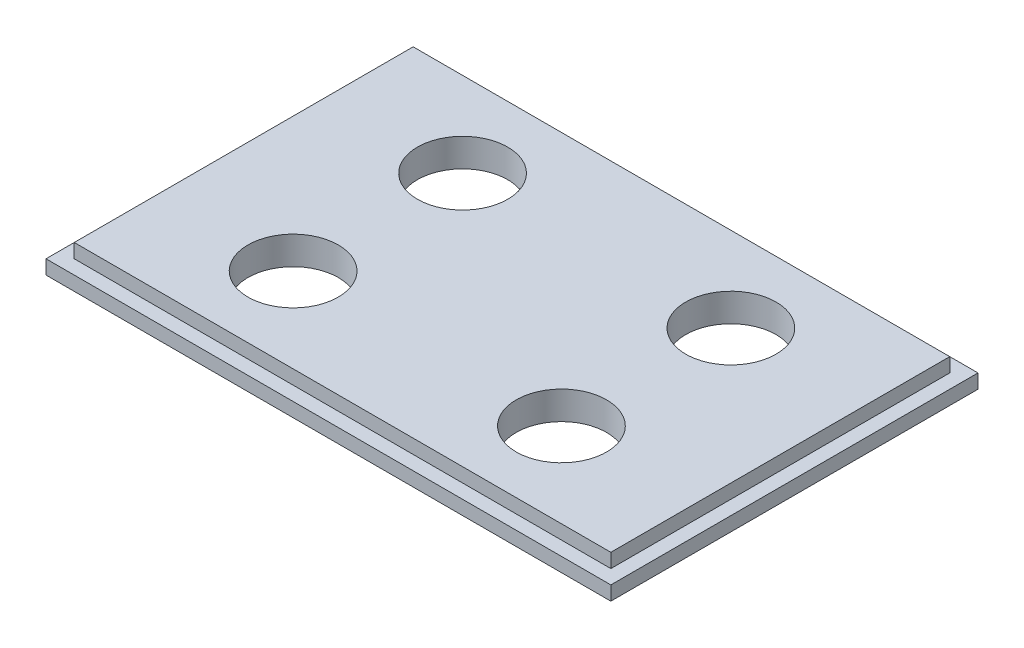
from build123d import *

# Parameters (mm, degrees)
SKETCH2_W           = 254
SKETCH2_H           = 165.1
BOSS_EXTRUDE1_DEPTH = 6.35
SKETCH3_W           = 241.3
SKETCH3_H           = 152.4
BOSS_EXTRUDE2_DEPTH = 6.35
SKETCH4_R           = 20.32
CUT_EXTRUDE2_DEPTH  = 153.002606886


with BuildPart() as part:
    # Sketch2 → Boss-Extrude1 (new body)
    with BuildSketch(Plane(origin=(0, 0, 0), x_dir=(1, 0, 0), z_dir=(0, 1, 0))):
        Rectangle(SKETCH2_W, SKETCH2_H)
    extrude(amount=BOSS_EXTRUDE1_DEPTH)

    # Sketch3 → Boss-Extrude2 (add)
    with BuildSketch(Plane(origin=(0, 6.35, 0), x_dir=(1, 0, 0), z_dir=(0, 1, 0))):
        Rectangle(SKETCH3_W, SKETCH3_H)
    extrude(amount=BOSS_EXTRUDE2_DEPTH)

    # Sketch4 → Cut-Extrude2 (cut, through all)
    with BuildSketch(Plane(origin=(0, 12.7, 0), x_dir=(1, 0, 0), z_dir=(0, 1, 0))):
        with Locations(Location((-60.325, 38.1, 0), (0, 0, 270))):
            Circle(SKETCH4_R)
        with Locations(Location((60.325, 38.1, 0), (0, 0, 90))):
            Circle(SKETCH4_R)
        with Locations(Location((60.325, -38.1, 0), (0, 0, 270))):
            Circle(SKETCH4_R)
        with Locations(Location((-60.325, -38.1, 0), (0, 0, 90))):
            Circle(SKETCH4_R)
    extrude(amount=-CUT_EXTRUDE2_DEPTH, mode=Mode.SUBTRACT)


solid = part.part
